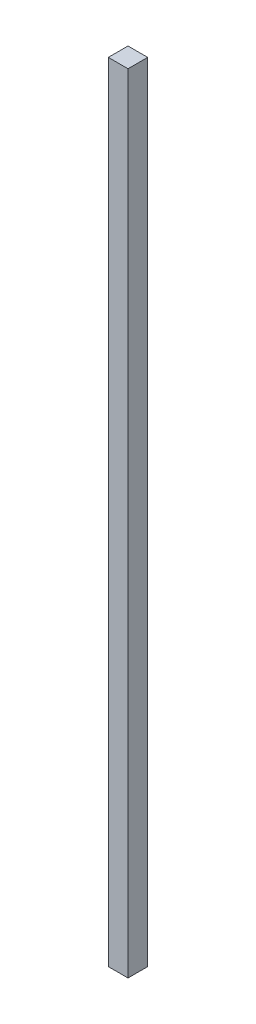
from build123d import *

# Parameters (mm, degrees)
SKETCH1_W           = 3.175
SKETCH1_H           = 3.175
BOSS_EXTRUDE1_DEPTH = 127


with BuildPart() as part:
    # Sketch1 → Boss-Extrude1 (new body)
    with BuildSketch(Plane(origin=(0, 0, 0), x_dir=(1, 0, 0), z_dir=(0, 1, 0))):
        Rectangle(SKETCH1_W, SKETCH1_H)
    extrude(amount=BOSS_EXTRUDE1_DEPTH)


solid = part.part
